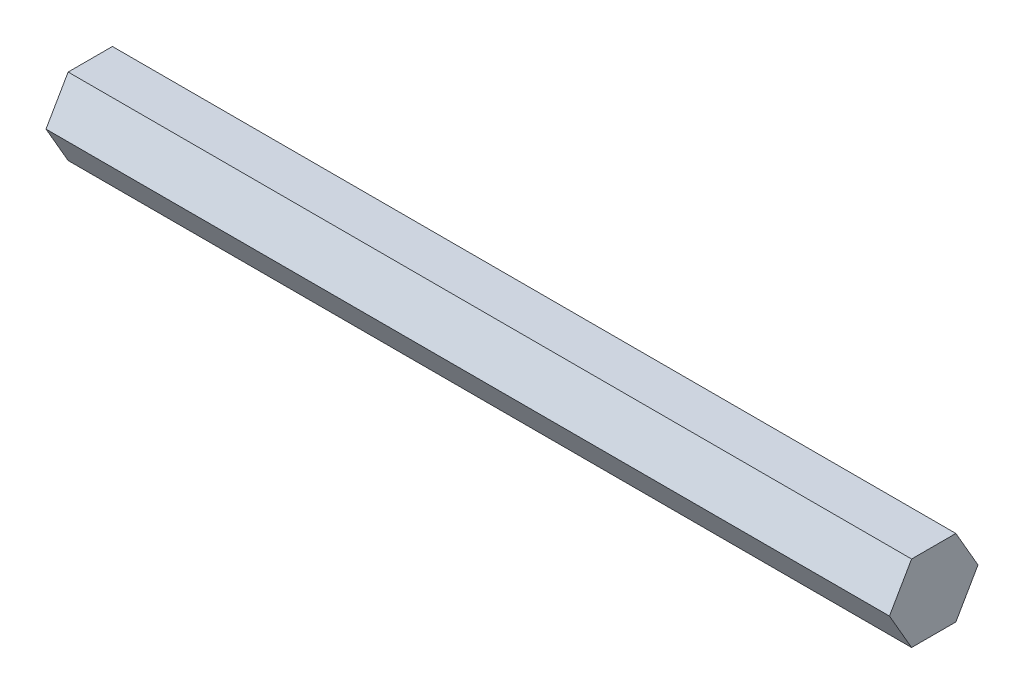
from build123d import *

# Parameters (mm, degrees)
BOSS_EXTRUDE2_DEPTH = 69.85


with BuildPart() as part:
    # Sketch3 → Boss-Extrude2 (new, symmetric)
    with BuildSketch(Plane(origin=(0, 0, 0), x_dir=(0, 0, -1), z_dir=(1, 0, 0))):
        Polygon((7.332348419, 0), (3.666174209, 6.35), (-3.666174209, 6.35), (-7.332348419, 0), (-3.666174209, -6.35), (3.666174209, -6.35), align=None)
    extrude(amount=BOSS_EXTRUDE2_DEPTH, both=True)


solid = part.part
